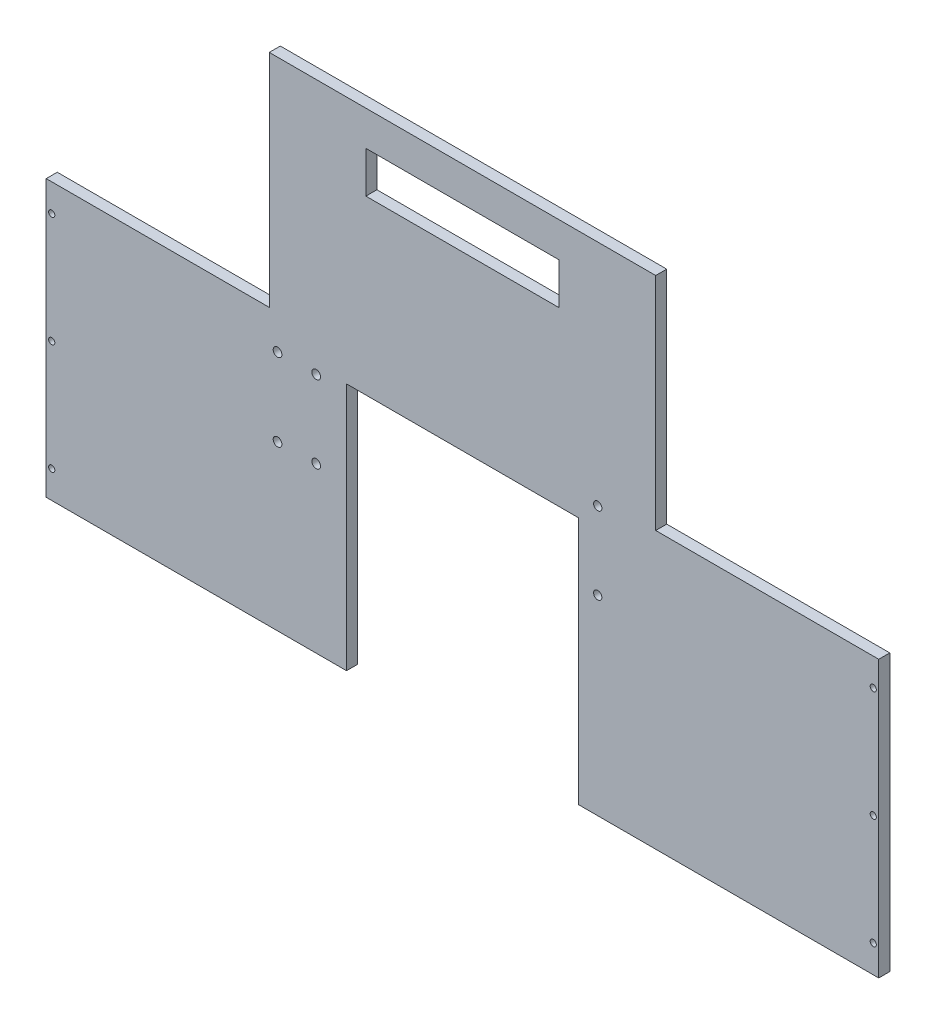
from build123d import *

# Parameters (mm, degrees)
BOSS_EXTRUDE1_DEPTH = 5.08
SKETCH2_R           = 2
CUT_EXTRUDE1_DEPTH  = 5.08
SKETCH3_R           = 1.905
CUT_EXTRUDE2_DEPTH  = 5.08
SKETCH4_W           = 102.616
SKETCH4_H           = 127
BOSS_EXTRUDE2_DEPTH = 5.08
SKETCH8_W           = 88.9
SKETCH8_H           = 19.05
CUT_EXTRUDE3_DEPTH  = 50.8
SKETCH9_R           = 1.4224
CUT_EXTRUDE4_DEPTH  = 10.16


with BuildPart() as part:
    # Sketch1 → Boss-Extrude1 (new body)
    with BuildSketch(Plane.XY):
        Polygon((0, 0), (0, 228.6), (177.8, 228.6), (177.8, 0), (142.24, 0), (142.24, 114.3), (35.56, 114.3), (35.56, 0), align=None)
    extrude(amount=BOSS_EXTRUDE1_DEPTH)

    # Sketch2 → Cut-Extrude1 (cut)
    with BuildSketch(Plane(origin=(0, 0, 0), x_dir=(-1, 0, 0), z_dir=(0, 0, -1))):
        with Locations((-21.59, 111.071616712)):
            Circle(SKETCH2_R)
        with Locations((-3.811028038, 111.071616712)):
            Circle(SKETCH2_R)
        with Locations((-21.59, 75.511616712)):
            Circle(SKETCH2_R)
        with Locations((-3.811028038, 75.320420507)):
            Circle(SKETCH2_R)
    extrude(amount=-CUT_EXTRUDE1_DEPTH, mode=Mode.SUBTRACT)

    # Sketch3 → Cut-Extrude2 (cut)
    with BuildSketch(Plane(origin=(0, 0, 0), x_dir=(-1, 0, 0), z_dir=(0, 0, -1))):
        with Locations((-151.12245979, 123.444)):
            Circle(SKETCH3_R)
        with Locations((-151.12245979, 87.884)):
            Circle(SKETCH3_R)
    extrude(amount=-CUT_EXTRUDE2_DEPTH, mode=Mode.SUBTRACT)

    # Sketch4 → Boss-Extrude2 (add)
    with BuildSketch(Plane(origin=(0, 0, 0), x_dir=(-1, 0, 0), z_dir=(0, 0, -1))):
        with Locations((51.308, 63.5)):
            Rectangle(SKETCH4_W, SKETCH4_H)
        with Locations((-229.108, 63.5)):
            Rectangle(SKETCH4_W, SKETCH4_H)
    extrude(amount=-BOSS_EXTRUDE2_DEPTH)

    # Sketch8 → Cut-Extrude3 (cut)
    with BuildSketch(Plane(origin=(0, 0, 0), x_dir=(-1, 0, 0), z_dir=(0, 0, -1))):
        with Locations((-88.9, 203.073)):
            Rectangle(SKETCH8_W, SKETCH8_H)
    extrude(amount=-CUT_EXTRUDE3_DEPTH, mode=Mode.SUBTRACT)

    # Sketch9 → Cut-Extrude4 (cut)
    with BuildSketch(Plane(origin=(0, 0, 0), x_dir=(-1, 0, 0), z_dir=(0, 0, -1))):
        with Locations((100.076, 12.7)):
            Circle(SKETCH9_R)
        with Locations((100.076, 63.5)):
            Circle(SKETCH9_R)
        with Locations((100.076, 114.3)):
            Circle(SKETCH9_R)
        with Locations((-277.876, 63.5)):
            Circle(SKETCH9_R)
        with Locations((-277.876, 114.3)):
            Circle(SKETCH9_R)
        with Locations((-277.876, 12.7)):
            Circle(SKETCH9_R)
    extrude(amount=-CUT_EXTRUDE4_DEPTH, mode=Mode.SUBTRACT)


solid = part.part
